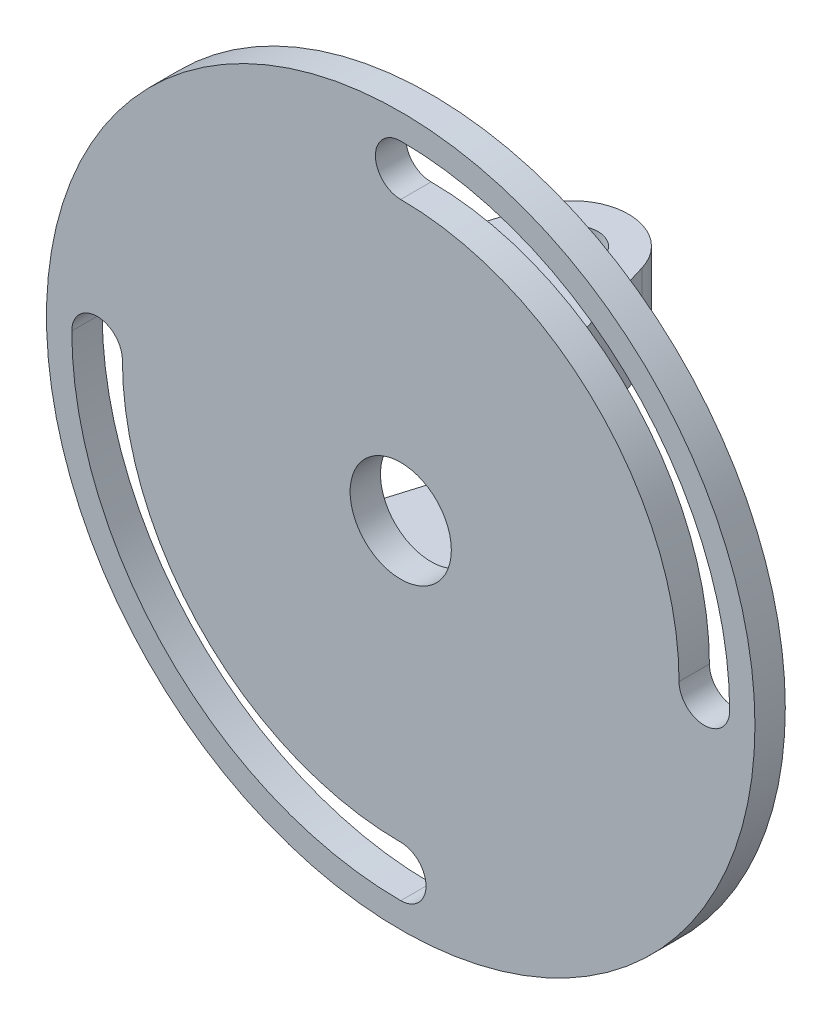
from build123d import *

# Parameters (mm, degrees)
SKETCH_5_R               = 2.5
EXTRUDE_3_DEPTH          = 15
SKETCH_1_R               = 35
SKETCH_1_R_2             = 5
EXTRUDE_4_DEPTH          = 3
CUT_EXTRUDE_1_DEPTH      = 54.200093985
CUT_EXTRUDE_1_DEPTH_BACK = 54.200093985
SKETCH_4_W               = 25
SKETCH_4_H               = 12


with BuildPart() as part:
    # 스케치5 → 보스-돌출3 (new, symmetric)
    with BuildSketch(Plane(origin=(0, 0, 0), x_dir=(1, 0, 0), z_dir=(0, 1, 0))):
        with BuildLine():
            Line((-10, 0), (10, 0))
            Line((10, 0), (5.262640911, 15.598314937))
            ThreePointArc((5.262640911, 15.598314937), (0, 19.5), (-5.262640911, 15.598314937))
            Line((-5.262640911, 15.598314937), (-10, 0))
        make_face()
        with Locations(Location((0, 14, 0), (0, 0, 270))):
            Circle(SKETCH_5_R, mode=Mode.SUBTRACT)
    extrude(amount=EXTRUDE_3_DEPTH, both=True)

    # 스케치1 → 보스-돌출4 (add)
    with BuildSketch(Plane.XY):
        Circle(SKETCH_1_R)
        with BuildLine():
            ThreePointArc((32.5, 0), (30, -2.5), (27.5, 0))
            ThreePointArc((27.5, 0), (19.445436483, 19.445436483), (0, 27.5))
            ThreePointArc((0, 27.5), (-2.5, 30), (0, 32.5))
            ThreePointArc((0, 32.5), (22.980970389, 22.980970389), (32.5, 0))
        make_face(mode=Mode.SUBTRACT)
        with BuildLine():
            ThreePointArc((0, -27.5), (2.5, -30), (0, -32.5))
            ThreePointArc((0, -32.5), (-22.980970405, -22.980970372), (-32.5, 4.6e-08))
            ThreePointArc((-32.5, 4.6e-08), (-29.999999977, 2.5), (-27.5, 0))
            ThreePointArc((-27.5, 0), (-19.445436483, -19.445436483), (0, -27.5))
        make_face(mode=Mode.SUBTRACT)
        Circle(SKETCH_1_R_2, mode=Mode.SUBTRACT)
    extrude(amount=EXTRUDE_4_DEPTH)

    # 스케치4 → 컷-돌출1 (cut, two sides: drawn at the far end of the back side and taken through both)
    with BuildSketch(Plane(origin=(0, 0, 0), x_dir=(0, 0, -1), z_dir=(1, 0, 0)).offset(-CUT_EXTRUDE_1_DEPTH_BACK)):
        with Locations((12.5, 0)):
            Rectangle(SKETCH_4_W, SKETCH_4_H)
    extrude(amount=CUT_EXTRUDE_1_DEPTH + CUT_EXTRUDE_1_DEPTH_BACK, mode=Mode.SUBTRACT)


solid = part.part
